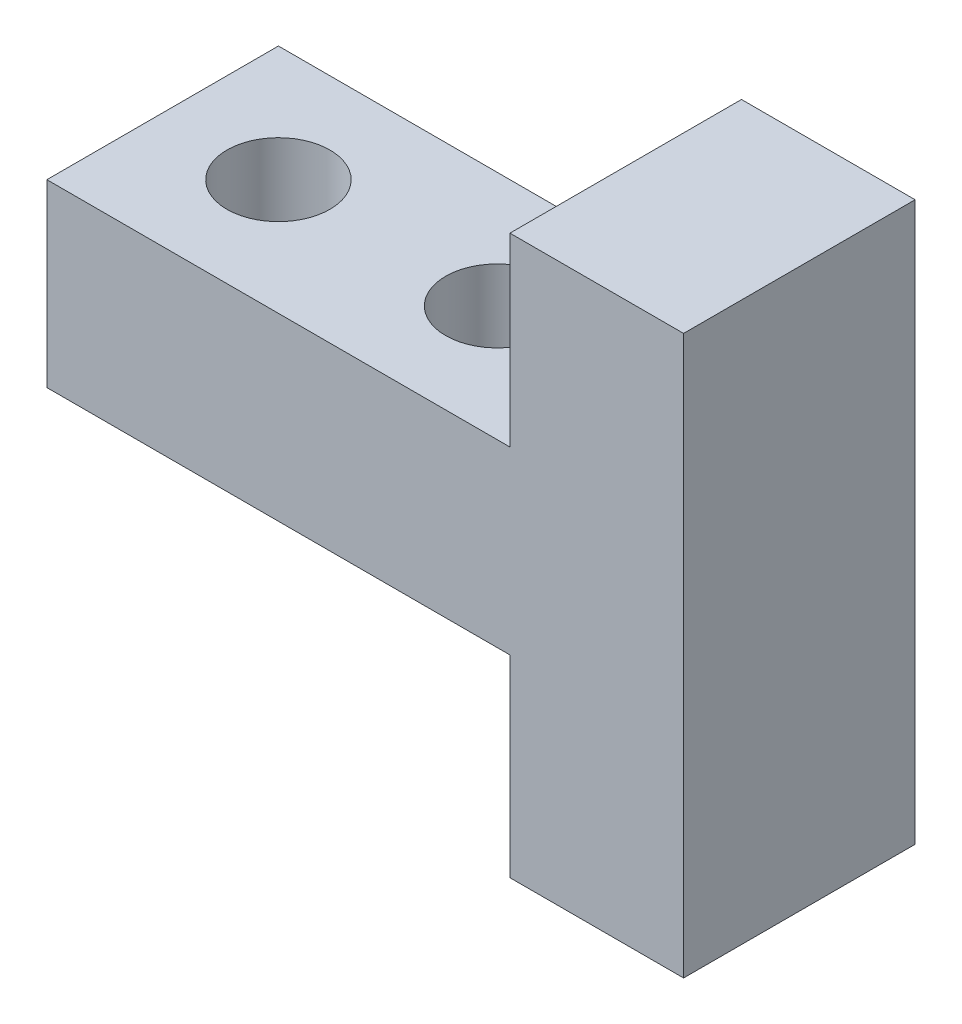
from build123d import *

# Parameters (mm, degrees)
BODY_DEPTH   = 9
SK_HOLE_V_R  = 4
HOLE_V_DEPTH = 59.071077138


with BuildPart() as part:
    # sk-body → body (new, symmetric)
    with BuildSketch(Plane.XY):
        Polygon((-13.5, 28.4), (0, 28.4), (0, -15), (-13.5, -15), (-13.5, 0), (-49.5, 0), (-49.5, 14), (-13.5, 14), align=None)
    extrude(amount=BODY_DEPTH, both=True)

    # sk-hole_v → hole_v (cut, through all)
    with BuildSketch(Plane(origin=(0, 14, 0), x_dir=(-1, 0, 0), z_dir=(0, 1, 0))):
        with Locations(Location((40.5, 0, 0), (0, 0, 90))):
            Circle(SK_HOLE_V_R)
        with Locations(Location((23.5, 0, 0), (0, 0, 90))):
            Circle(SK_HOLE_V_R)
    extrude(amount=-HOLE_V_DEPTH, mode=Mode.SUBTRACT)


solid = part.part
